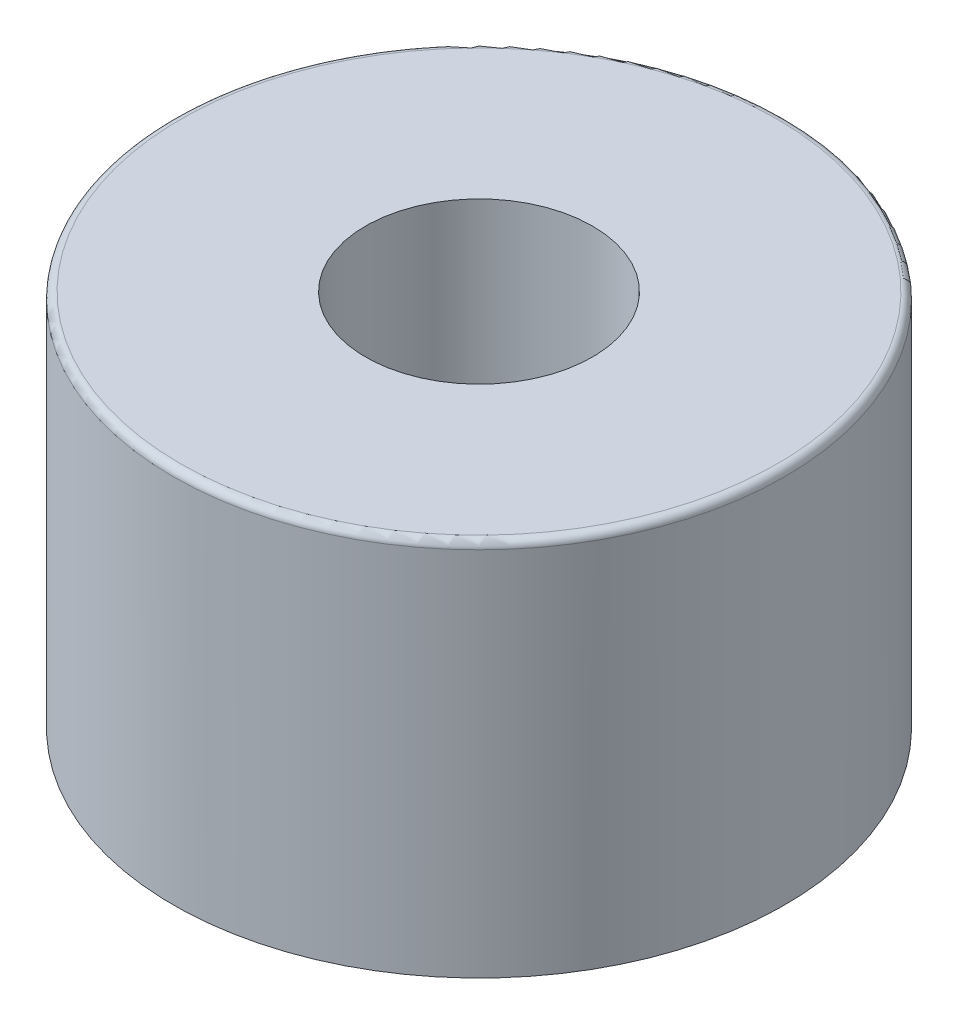
from build123d import *

# Parameters (mm, degrees)
SKETCH1_R           = 12.319
SKETCH1_R_2         = 4.572
BOSS_EXTRUDE1_DEPTH = 15.24
FILLET1_R           = 0.3


with BuildPart() as part:
    # Sketch1 → Boss-Extrude1 (new body)
    with BuildSketch(Plane(origin=(0, 0, 0), x_dir=(1, 0, 0), z_dir=(0, 1, 0))):
        with Locations(Location((0, 0, 0), (0, 0, 90))):
            Circle(SKETCH1_R)
        with Locations(Location((0, 0, 0), (0, 0, 90))):
            Circle(SKETCH1_R_2, mode=Mode.SUBTRACT)
    extrude(amount=BOSS_EXTRUDE1_DEPTH)

    # Fillet1
    fillet1_edges = [part.edges().sort_by_distance(p)[0] for p in [
        (0, 15.24, 12.319),
    ]]
    fillet(fillet1_edges, radius=FILLET1_R)


solid = part.part
